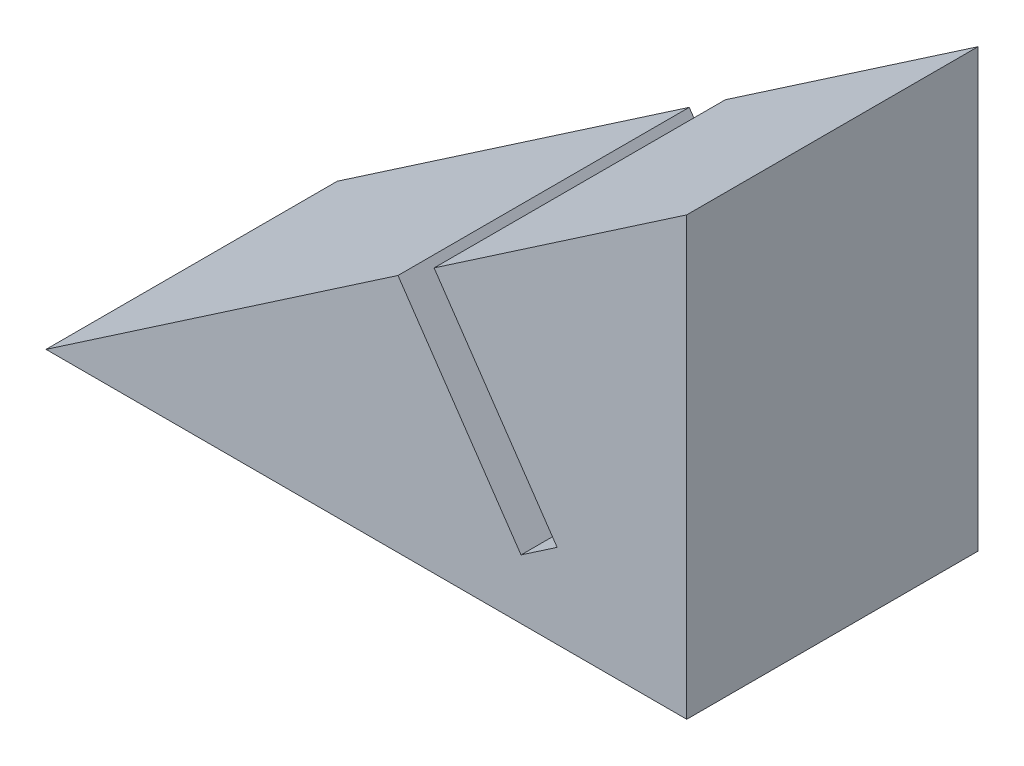
from build123d import *

# Parameters (mm, degrees)
RESSALTO_EXTRUS_O1_DEPTH = 10


with BuildPart() as part:
    # Esboço1 → Ressalto-extrusão1 (new body)
    with BuildSketch(Plane.XY):
        Polygon((0, 0), (0, 15), (-8.675387099, 9.084963341), (-4.450360915, 2.88825827), (-5.689701929, 2.043253033), (-9.914728114, 8.239958104), (-22, 0), align=None)
    extrude(amount=RESSALTO_EXTRUS_O1_DEPTH)


solid = part.part
